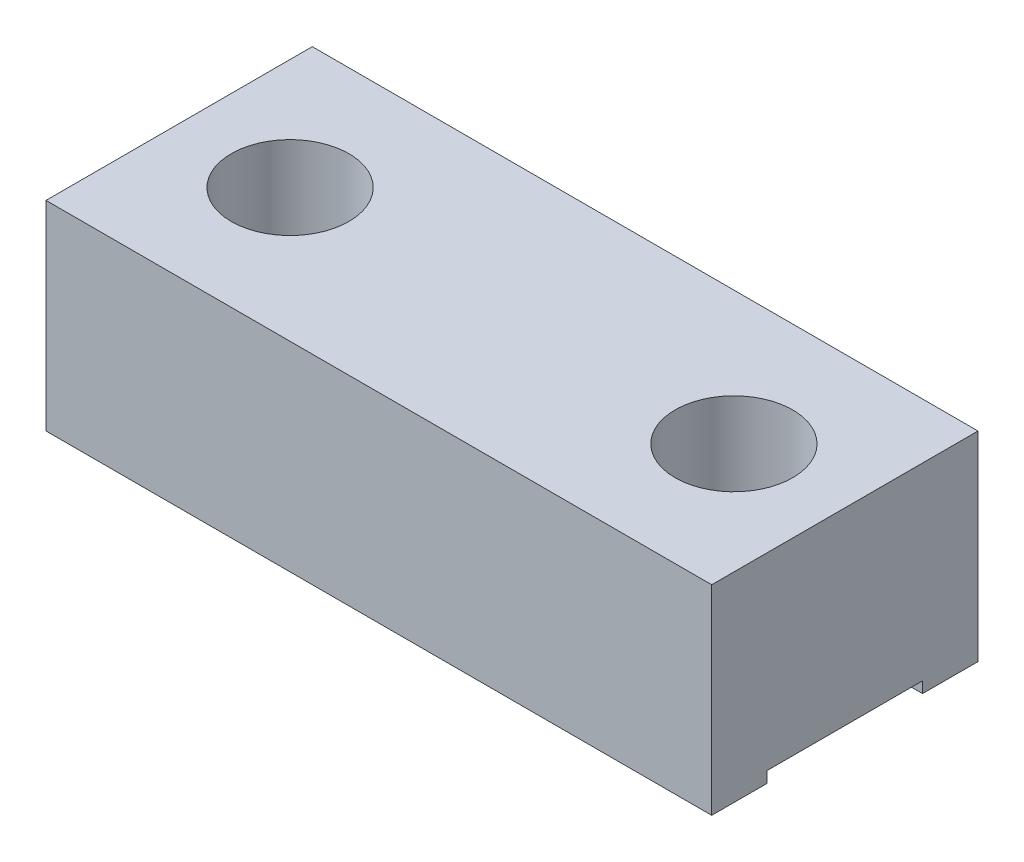
from build123d import *

# Parameters (mm, degrees)
BOSS_EXTRUDE3_DEPTH           = 20.5
BOSS_EXTRUDE3_DEPTH_BACK      = 20.5
CUT_EXTRUDE1_DEPTH            = 30.004310025
CUT_EXTRUDE1_DEPTH_BACK       = 30.004310025
SKETCH5_W                     = 12
SKETCH5_H                     = 11
SPLIT1_SURFACE_1_BACK         = 57.187
SPLIT1_SURFACE_1_DEPTH        = 114.374
SPLIT1_SURFACE_2_BACK         = 57.187
SPLIT1_SURFACE_2_DEPTH        = 114.374
M5_TAPPED_HOLE1_AT_2_COUNT    = 2
M5_TAPPED_HOLE1_AT_2_PITCH    = 20
SKETCH13_W                    = 2.65
SKETCH13_H                    = 8.5
M5_CLEARANCE_HOLE1_AT_2_COUNT = 2
M5_CLEARANCE_HOLE1_AT_2_PITCH = 20
SKETCH4_W                     = 1.65
SKETCH4_H                     = 25.5
SKETCH4_AT_POINT_2_W          = 1.65
SKETCH4_AT_POINT_2_H          = 25.5
SKETCH4_AT_POINT_3_W          = 1.65
SKETCH4_AT_POINT_3_H          = 25.5
SKETCH4_AT_POINT_4_W          = 1.65
SKETCH4_AT_POINT_4_H          = 25.5
CHAMFER1_SIZE                 = 2
CHAMFER2_SIZE                 = 1
CHAMFER2_SIZE2                = 1.732050808
FILLET1_R                     = 0.2


with BuildPart() as part:
    # Sketch3 → Boss-Extrude3 (new, two sides: drawn at the far end of the back side and taken through both)
    with BuildSketch(Plane(origin=(0, 0, 0), x_dir=(1, 0, 0), z_dir=(0, 1, 0)).offset(-BOSS_EXTRUDE3_DEPTH_BACK)):
        Polygon((10.5, -10), (10.5, 0), (12.5, 0), (12.5, 2), (15, 2), (15, 14), (-15, 14), (-15, 2), (-10.5, 2), (-10.5, 0), (-10.5, -10), align=None)
    extrude(amount=BOSS_EXTRUDE3_DEPTH + BOSS_EXTRUDE3_DEPTH_BACK)

    # Sketch5 → Cut-Extrude1 (cut, two sides: drawn at the far end of the back side and taken through both)
    with BuildSketch(Plane(origin=(0, 0, 0), x_dir=(0, 0, -1), z_dir=(1, 0, 0)).offset(-CUT_EXTRUDE1_DEPTH_BACK)):
        Polygon((2, 0.5), (4.5, 0.5), (4.5, 1), (11.5, 1), (11.5, 0.5), (14, 0.5), (14, -0.5), (11.5, -0.5), (11.5, -1), (4.5, -1), (4.5, -0.5), (2, -0.5), align=None)
        with Locations((8, 15)):
            Rectangle(SKETCH5_W, SKETCH5_H)
    extrude(amount=CUT_EXTRUDE1_DEPTH + CUT_EXTRUDE1_DEPTH_BACK, mode=Mode.SUBTRACT)


with BuildPart() as body_2:
    # Split1: the piece behind the surface
    add(part.part)
    # Split1 surface: a surface, the sketch's curves swept straight by 114.374 mm
    with BuildLine(Plane.ZY.offset(10.5).offset(-SPLIT1_SURFACE_1_BACK), mode=Mode.PRIVATE) as split1_surface_1_path:
        Line((-2, 20.5), (-2, -0.5))
    split1_surface_1 = Shell.extrude(split1_surface_1_path.wire(), (-1 * SPLIT1_SURFACE_1_DEPTH, 0 * SPLIT1_SURFACE_1_DEPTH, 0 * SPLIT1_SURFACE_1_DEPTH))
    split(bisect_by=split1_surface_1, keep=Keep.BOTTOM)

    # Sketch13 → M5 Clearance Hole1 (revolve, cut)
    with BuildSketch(Plane(origin=(-10, 9.5, -8), x_dir=(0, 0, 1), z_dir=(1, 0, 0))):
        with Locations((1.325, 4.25)):
            Rectangle(SKETCH13_W, SKETCH13_H)
    m5_clearance_hole1 = revolve(axis=Axis((-10, 15.85, -8), (0, -1, 0)), mode=Mode.SUBTRACT)

    # M5 Clearance Hole1 at 2: M5 Clearance Hole1 ×2
    with Locations(*[(i * M5_CLEARANCE_HOLE1_AT_2_PITCH, 0, 0) for i in range(1, M5_CLEARANCE_HOLE1_AT_2_COUNT)]):
        add(m5_clearance_hole1, mode=Mode.SUBTRACT)


with BuildPart() as part_1:
    add(part.part)

    # Split1: split by a surface, the side it looks to stays
    # Split1 surface: a surface, the sketch's curves swept straight by 114.374 mm
    with BuildLine(Plane.ZY.offset(10.5).offset(-SPLIT1_SURFACE_2_BACK), mode=Mode.PRIVATE) as split1_surface_2_path:
        Line((-2, 20.5), (-2, -0.5))
    split1_surface_2 = Shell.extrude(split1_surface_2_path.wire(), (-1 * SPLIT1_SURFACE_2_DEPTH, 0 * SPLIT1_SURFACE_2_DEPTH, 0 * SPLIT1_SURFACE_2_DEPTH))
    split(bisect_by=split1_surface_2, keep=Keep.TOP)

    # Sketch10 → M5 Tapped Hole1 (revolve, cut)
    with BuildSketch(Plane(origin=(-10, -1, -8), x_dir=(0, 0, 1), z_dir=(1, 0, 0))):
        Polygon((0, 0), (0, 15.2618073), (2.1, 14), (2.1, 0), align=None)
    m5_tapped_hole1 = revolve(axis=Axis((-10, 5.35, -8), (0, -1, 0)), mode=Mode.SUBTRACT)

    # M5 Tapped Hole1 at 2: M5 Tapped Hole1 ×2
    with Locations(*[(i * M5_TAPPED_HOLE1_AT_2_PITCH, 0, 0) for i in range(1, M5_TAPPED_HOLE1_AT_2_COUNT)]):
        add(m5_tapped_hole1, mode=Mode.SUBTRACT)

    # Sketch4 → M4 Tapped Hole1 (revolve, cut)
    with BuildSketch(Plane(origin=(10.5, 12.5, 5), x_dir=(0, 0, -1), z_dir=(0, 1, 0))):
        with Locations((0.825, 12.75)):
            Rectangle(SKETCH4_W, SKETCH4_H)
    revolve(axis=Axis((10.5, 12.5, 3.35), (0, 0, 1)), mode=Mode.SUBTRACT)

    # Sketch4 at point 2 (carried to point 2, square into its face) → M4 Tapped Hole1 at 2 (revolve, cut)
    with BuildSketch(Plane(origin=(10.5, -12.5, 5), x_dir=(1, 0, 0), z_dir=(0, 1, 0))):
        with Locations((0.825, 12.75)):
            Rectangle(SKETCH4_AT_POINT_2_W, SKETCH4_AT_POINT_2_H)
    revolve(axis=Axis((12.15, -12.5, 5), (-1, 0, 0)), mode=Mode.SUBTRACT)

    # Sketch4 at point 3 (carried to point 3, square into its face) → M4 Tapped Hole1 at 3 (revolve, cut)
    with BuildSketch(Plane(origin=(-10.5, 12.5, 5), x_dir=(-1, 0, 0), z_dir=(0, 1, 0))):
        with Locations((0.825, 12.75)):
            Rectangle(SKETCH4_AT_POINT_3_W, SKETCH4_AT_POINT_3_H)
    revolve(axis=Axis((-12.15, 12.5, 5), (1, 0, 0)), mode=Mode.SUBTRACT)

    # Sketch4 at point 4 (carried to point 4, square into its face) → M4 Tapped Hole1 at 4 (revolve, cut)
    with BuildSketch(Plane(origin=(-10.5, -12.5, 5), x_dir=(-1, 0, 0), z_dir=(0, 1, 0))):
        with Locations((0.825, 12.75)):
            Rectangle(SKETCH4_AT_POINT_4_W, SKETCH4_AT_POINT_4_H)
    revolve(axis=Axis((-12.15, -12.5, 5), (1, 0, 0)), mode=Mode.SUBTRACT)

    # Chamfer1
    chamfer1_edges = [part_1.edges().sort_by_distance(p)[0] for p in [
        (-10.5, -20.5, -2),
        (10.5, -20.5, -2),
        (10.5, 20.5, 7.5),
        (-10.5, 20.5, 0.675),
    ]]
    chamfer(chamfer1_edges, length=CHAMFER1_SIZE)

    # Chamfer2
    chamfer2_edges = [part_1.edges().sort_by_distance(p)[0] for p in [
        (0, -20.5, 10),
        (10.5, 0, 10),
        (-1, 20.5, 10),
        (-10.5, 1, 10),
        (-1, 20.5, 10),
        (9.5, 19.5, 10),
        (-9.5, -19.5, 10),
        (9.5, -19.5, 10),
    ]]
    chamfer2_side = [part_1.faces().sort_by_distance(p)[0] for p in [
        (-0.023001949, 0.046393762, 10),
    ]]
    chamfer(chamfer2_edges, length=CHAMFER2_SIZE, length2=CHAMFER2_SIZE2, reference=chamfer2_side[0])

    # Fillet1
    fillet1_edges = [part_1.edges().sort_by_distance(p)[0] for p in [
        (0, -0.5, -2),
    ]]
    fillet(fillet1_edges, radius=FILLET1_R)


solid = body_2.part
